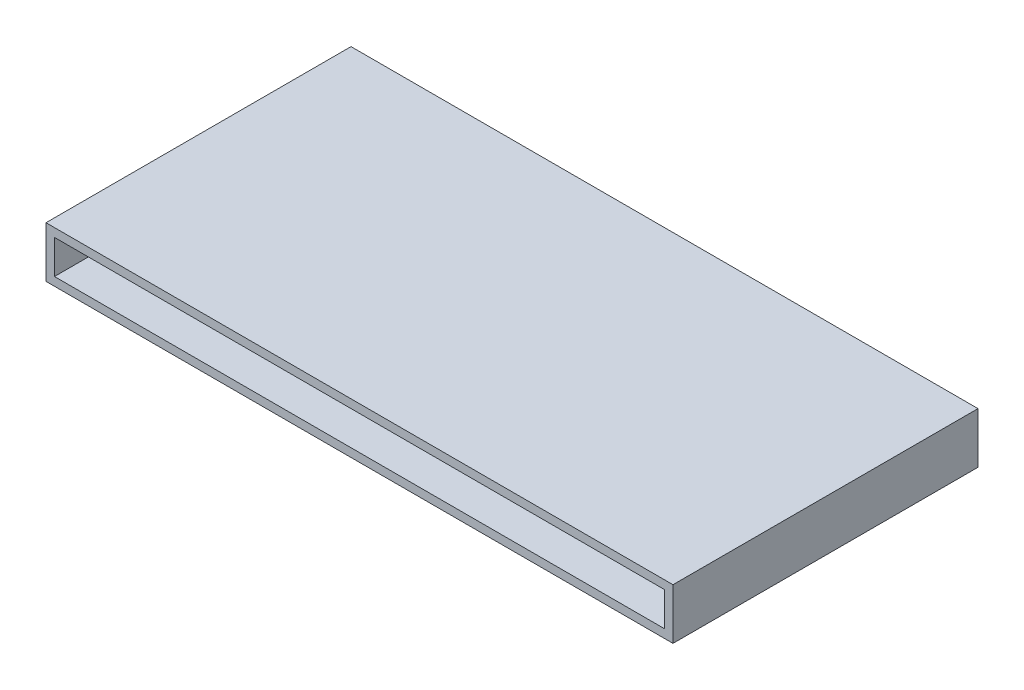
from build123d import *

# Parameters (mm, degrees)
SKETCH1_W     = 148
SKETCH1_H     = 12
SKETCH1_W_2   = 144
SKETCH1_H_2   = 8
PROFILE_DEPTH = 72
SKETCH2_W     = 144
SKETCH2_H     = 8
BACK_DEPTH    = 2


with BuildPart() as part:
    # Sketch1 → Profile (new body)
    with BuildSketch(Plane.XY):
        with Locations((74, 6)):
            Rectangle(SKETCH1_W, SKETCH1_H)
        with Locations((74, 6)):
            Rectangle(SKETCH1_W_2, SKETCH1_H_2, mode=Mode.SUBTRACT)
    extrude(amount=PROFILE_DEPTH)

    # Sketch2 → Back (add)
    with BuildSketch(Plane.XY):
        with Locations((74, 6)):
            Rectangle(SKETCH2_W, SKETCH2_H)
    extrude(amount=BACK_DEPTH)


solid = part.part
